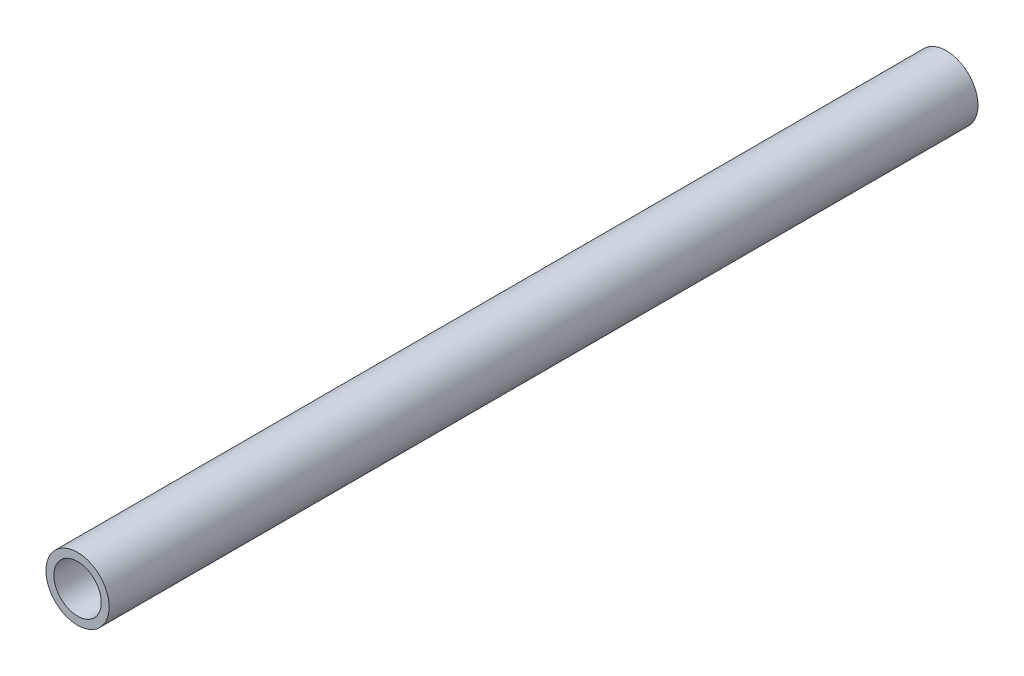
from build123d import *

# Parameters (mm, degrees)
SKETCH1_R           = 4
SKETCH1_R_2         = 3
BOSS_EXTRUDE1_DEPTH = 110


with BuildPart() as part:
    # Sketch1 → Boss-Extrude1 (new body)
    with BuildSketch(Plane.XY):
        Circle(SKETCH1_R)
        Circle(SKETCH1_R_2, mode=Mode.SUBTRACT)
    extrude(amount=BOSS_EXTRUDE1_DEPTH)


solid = part.part
